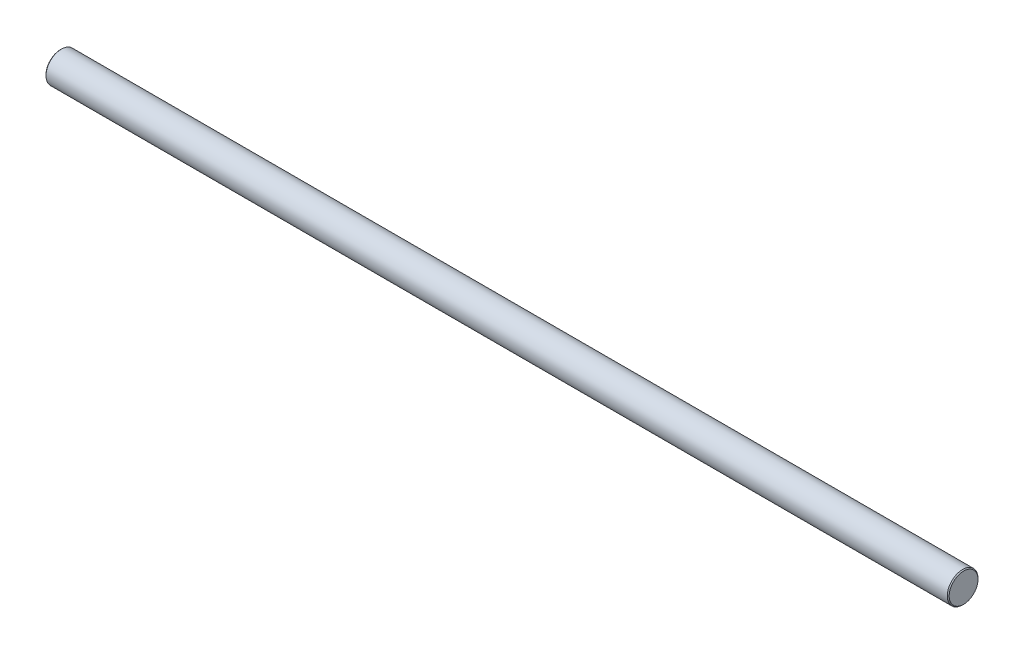
from build123d import *

# Parameters (mm, degrees)
SKETCH1_R           = 4
BOSS_EXTRUDE1_DEPTH = 117.5
CHAMFER1_SIZE       = 0.25


with BuildPart() as part:
    # Sketch1 → Boss-Extrude1 (new, symmetric)
    with BuildSketch(Plane(origin=(0, 0, 0), x_dir=(0, 0, -1), z_dir=(1, 0, 0))):
        with Locations(Location((0, 0, 0), (0, 0, 180))):
            Circle(SKETCH1_R)
    extrude(amount=BOSS_EXTRUDE1_DEPTH, both=True)

    # Chamfer1
    chamfer1_edges = [part.edges().sort_by_distance(p)[0] for p in [
        (-117.5, 0, -4),
        (117.5, 0, -4),
    ]]
    chamfer(chamfer1_edges, length=CHAMFER1_SIZE)


solid = part.part
